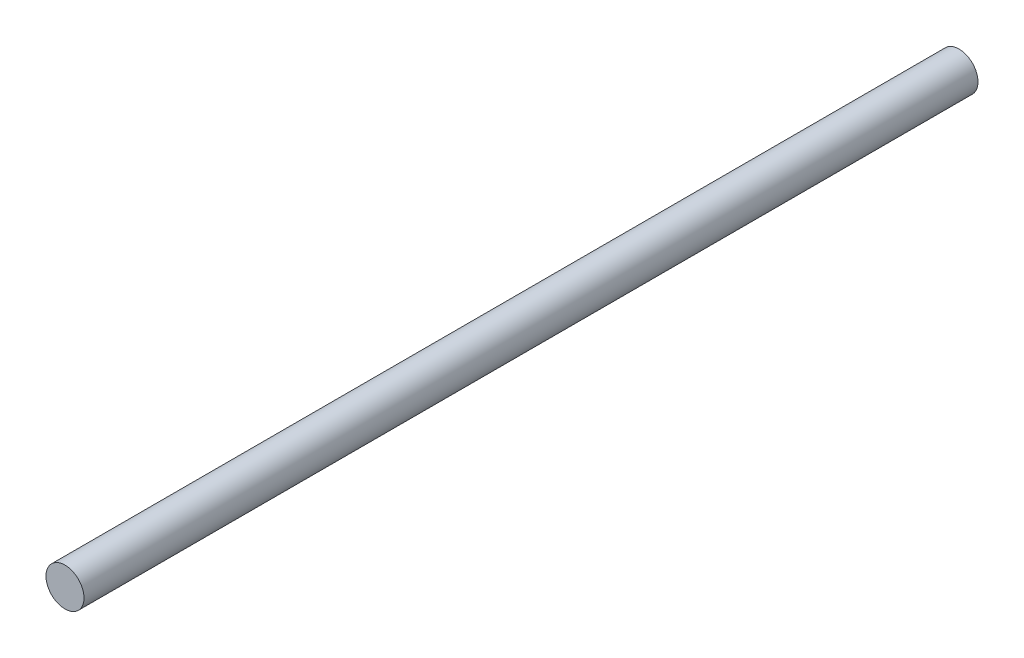
from build123d import *

# Parameters (mm, degrees)
BOSS_EXTRUDE1_DEPTH      = 25
BOSS_EXTRUDE1_DEPTH_BACK = 22
SKETCH1_R                = 1


with BuildPart() as part:
    # Sketch1 → Boss-Extrude1 (new, two sides: drawn at the far end of the back side and taken through both)
    with BuildSketch(Plane.XY.offset(-BOSS_EXTRUDE1_DEPTH_BACK)):
        Circle(SKETCH1_R)
    extrude(amount=BOSS_EXTRUDE1_DEPTH + BOSS_EXTRUDE1_DEPTH_BACK)


solid = part.part
